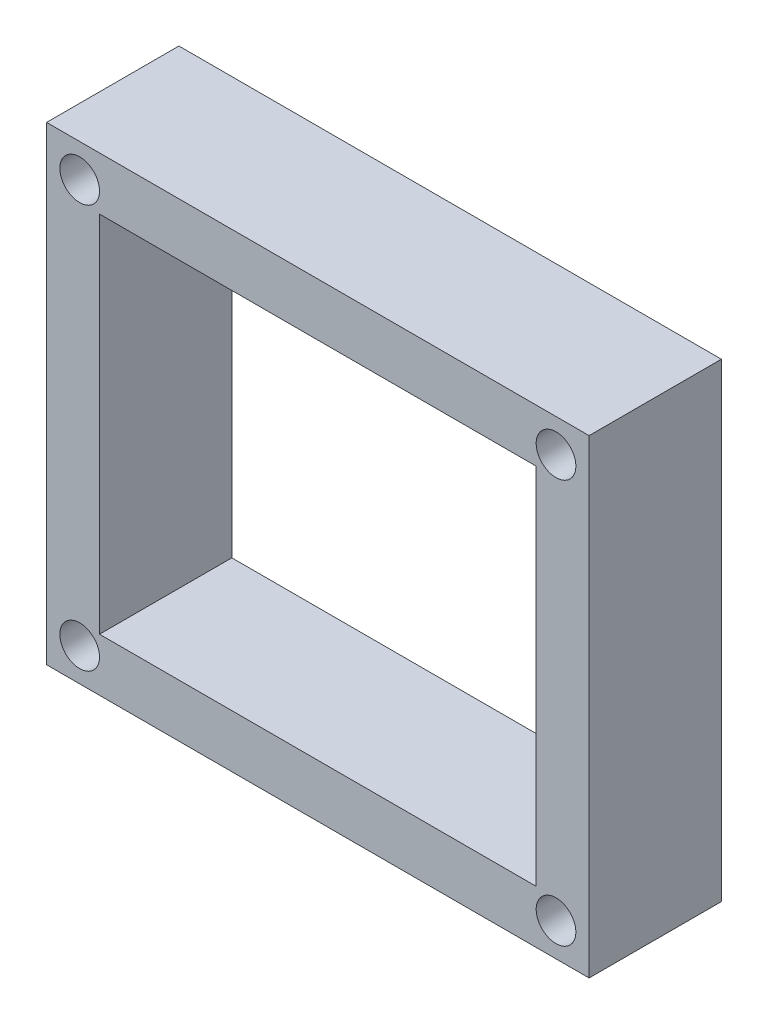
from build123d import *

# Parameters (mm, degrees)
SKETCH_1_W          = 82
SKETCH_1_H          = 71
SKETCH_1_R          = 3
SKETCH_1_W_2        = 66
SKETCH_1_H_2        = 55
EXTRUDE_1_DEPTH     = 20
SKETCH_1_3_R        = 3
CUT_EXTRUDE_1_DEPTH = 20


with BuildPart() as part:
    # 草图1 → 凸台-拉伸1 (new body)
    with BuildSketch(Plane.XY):
        Rectangle(SKETCH_1_W, SKETCH_1_H)
        with Locations((-36, 30.5)):
            Circle(SKETCH_1_R, mode=Mode.SUBTRACT)
        with Locations((-36, -30.5)):
            Circle(SKETCH_1_R, mode=Mode.SUBTRACT)
        Rectangle(SKETCH_1_W_2, SKETCH_1_H_2, mode=Mode.SUBTRACT)
    extrude(amount=EXTRUDE_1_DEPTH)

    # 草图1<3> → 切除-拉伸1 (cut)
    with BuildSketch(Plane.XY):
        with Locations((36, -30.5)):
            Circle(SKETCH_1_3_R)
        with Locations((36, 30.5)):
            Circle(SKETCH_1_3_R)
    extrude(amount=CUT_EXTRUDE_1_DEPTH, mode=Mode.SUBTRACT)


solid = part.part
